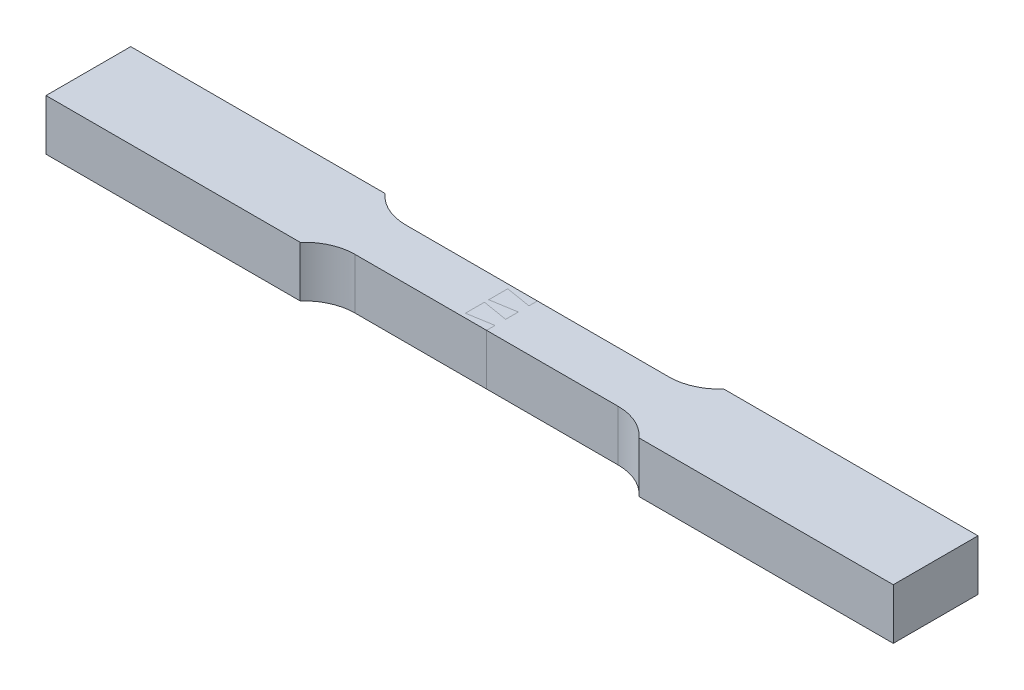
from build123d import *

# Parameters (mm, degrees)
BOSS_EXTRUDE1_DEPTH = 6
BOSS_EXTRUDE3_DEPTH = 6


with BuildPart() as part:
    # Sketch1 → Boss-Extrude1 (new body)
    with BuildSketch(Plane(origin=(0, 0, 0), x_dir=(1, 0, 0), z_dir=(0, 1, 0))):
        with BuildLine():
            Line((-15.527864045, -3), (0, -3))
            Line((0, -3), (0, -2))
            Line((0, -2), (-3, -2.5))
            Line((-3, -2.5), (-3, -0.25))
            Line((-3, -0.25), (0, -0.75))
            Line((0, -0.75), (0, 0.75))
            Line((0, 0.75), (-3, 0.25))
            Line((-3, 0.25), (-3, 2.5))
            Line((-3, 2.5), (0, 2))
            Line((0, 2), (0, 3))
            Line((0, 3), (-15.527864045, 3))
            ThreePointArc((-15.527864045, 3), (-17.977353788, 3.522774425), (-20, 5))
            Line((-20, 5), (-50, 5))
            Line((-50, 5), (-50, -5))
            Line((-50, -5), (-20, -5))
            ThreePointArc((-20, -5), (-17.977353788, -3.522774425), (-15.527864045, -3))
        make_face()
    extrude(amount=BOSS_EXTRUDE1_DEPTH)


with BuildPart() as body_2:
    # Sketch1<4> → Boss-Extrude3 (new body)
    with BuildSketch(Plane(origin=(0, 0, 0), x_dir=(1, 0, 0), z_dir=(0, 1, 0))):
        with BuildLine():
            Line((0, -3), (15.527864045, -3))
            ThreePointArc((15.527864045, -3), (17.977353788, -3.522774425), (20, -5))
            Line((20, -5), (50, -5))
            Line((50, -5), (50, 5))
            Line((50, 5), (20, 5))
            ThreePointArc((20, 5), (17.977353788, 3.522774425), (15.527864045, 3))
            Line((15.527864045, 3), (0, 3))
            Line((0, 3), (0, 2))
            Line((0, 2), (-3, 2.5))
            Line((-3, 2.5), (-3, 0.25))
            Line((-3, 0.25), (0, 0.75))
            Line((0, 0.75), (0, -0.75))
            Line((0, -0.75), (-3, -0.25))
            Line((-3, -0.25), (-3, -2.5))
            Line((-3, -2.5), (0, -2))
            Line((0, -2), (0, -3))
        make_face()
    extrude(amount=BOSS_EXTRUDE3_DEPTH)


solid = Compound([part.part, body_2.part])
